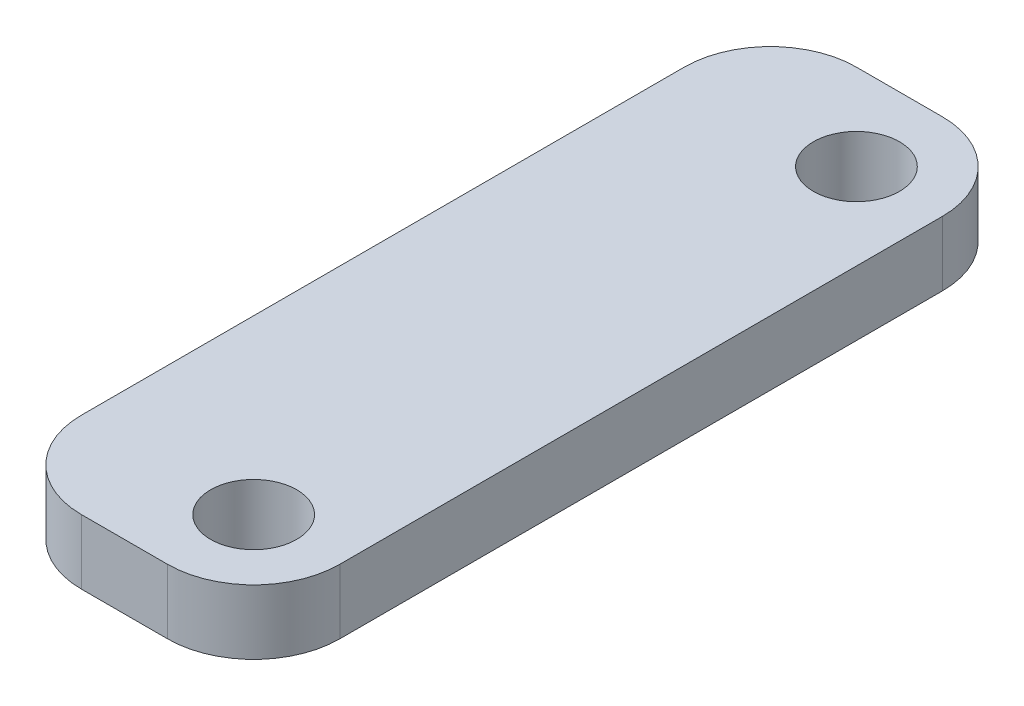
from build123d import *

# Parameters (mm, degrees)
SKETCH1_W           = 12
SKETCH1_H           = 36
SKETCH1_R           = 2
BOSS_EXTRUDE1_DEPTH = 1.5
FILLET1_R           = 4


with BuildPart() as part:
    # Sketch1 → Boss-Extrude1 (new, symmetric)
    with BuildSketch(Plane(origin=(0, 0, 0), x_dir=(1, 0, 0), z_dir=(0, 1, 0))):
        Rectangle(SKETCH1_W, SKETCH1_H)
        with Locations(Location((2, 14, 0), (0, 0, 270))):
            Circle(SKETCH1_R, mode=Mode.SUBTRACT)
        with Locations(Location((2, -14, 0), (0, 0, 90))):
            Circle(SKETCH1_R, mode=Mode.SUBTRACT)
    extrude(amount=BOSS_EXTRUDE1_DEPTH, both=True)

    # Fillet1
    fillet1_edges = [part.edges().sort_by_distance(p)[0] for p in [
        (6, 0, 18),
        (-6, 0, 18),
        (-6, 0, -18),
        (6, 0, -18),
    ]]
    fillet(fillet1_edges, radius=FILLET1_R)


solid = part.part
